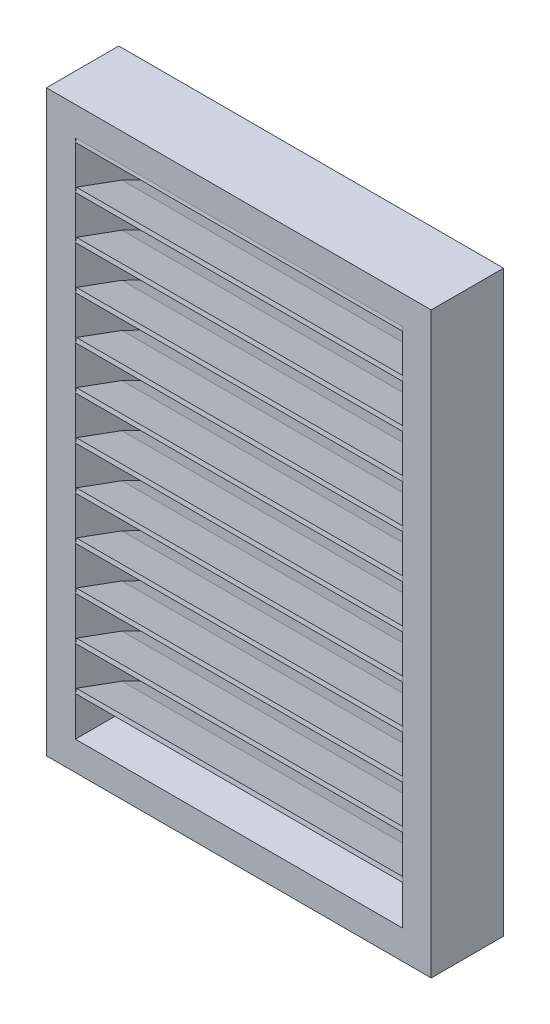
from build123d import *

# Parameters (mm, degrees)
SKETCH2_W           = 1330
SKETCH2_H           = 2000
SKETCH2_W_2         = 1130
SKETCH2_H_2         = 1800
BOSS_EXTRUDE1_DEPTH = 250
BOSS_EXTRUDE7_DEPTH = 1130
LPATTERN1_COUNT     = 12
LPATTERN1_PITCH     = 150


with BuildPart() as part:
    # Sketch2 → Boss-Extrude1 (new body)
    with BuildSketch(Plane.XY):
        with Locations((665, 1000)):
            Rectangle(SKETCH2_W, SKETCH2_H)
        with Locations((665, 1000)):
            Rectangle(SKETCH2_W_2, SKETCH2_H_2, mode=Mode.SUBTRACT)
    extrude(amount=BOSS_EXTRUDE1_DEPTH)

    # Sketch3 → Boss-Extrude7 (add)
    with BuildSketch(Plane.ZY.offset(-1230)):
        Polygon((246.765642086, 250.862492694), (89.126120187, 193.08857144), (1.010099694, 150.233608791), (7.570564006, 136.74434239), (96.599479861, 180.043288966), (249.443207232, 236.059580838), align=None)
    boss_extrude7 = extrude(amount=BOSS_EXTRUDE7_DEPTH)

    # LPattern1: Boss-Extrude7 ×12
    with Locations(*[(0, i * LPATTERN1_PITCH, 0) for i in range(1, LPATTERN1_COUNT)]):
        add(boss_extrude7)


solid = part.part
